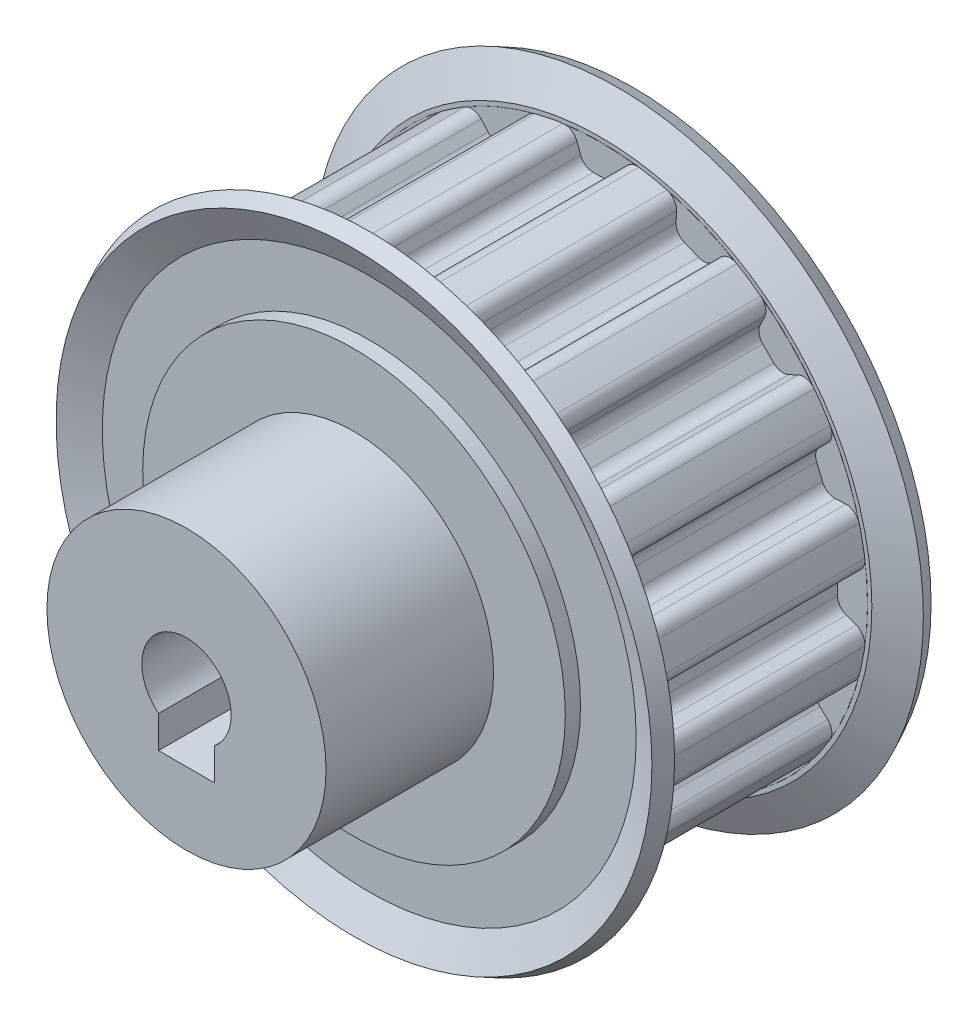
from build123d import *

# Parameters (mm, degrees)
TOOTH_EXTRUDE_START      = -9.6
TOOTH_EXTRUDE_DEPTH      = 19.2
PATTERN_CIRCULAR_1_COUNT = 16
SKETCH_8_R               = 12.5
EXTRUDE_1_DEPTH          = 15
SKETCH_3_R               = 4
CUT_EXTRUDE_2_DEPTH      = 56.639818872
SKETCH_9_W               = 5
SKETCH_9_H               = 2.877501001
CUT_EXTRUDE_4_DEPTH      = 56.639818872


with BuildPart() as part:
    # GearBelt-BaseSketch → 0.375in Pitch 'L', 0.500in Belt Width, 48.5104mm P.D. (revolve)
    with BuildSketch(Plane(origin=(0, 0, 0), x_dir=(0, 0, -1), z_dir=(1, 0, 0)), mode=Mode.PRIVATE) as f_0_375in_pitch_l_0_500in_belt_width_48_sk:
        Polygon((-12.5, 0), (12.5, 0), (12.5, 18.92121315), (11.136655508, 18.92121315), (11.136655508, 23.902323777), (12.5, 26.678029552), (11.136655665, 27.347663923), (9.617735498, 24.255213332), (9.617735498, 23.874213327), (-9.617735498, 23.874213327), (-9.617735498, 24.255213332), (-11.136655665, 27.347663923), (-12.5, 26.678029552), (-11.136655508, 23.902323777), (-11.136655508, 18.92121315), (-12.5, 18.92121315), align=None)
    revolve(f_0_375in_pitch_l_0_500in_belt_width_48_sk.sketch.rotate(Axis((0, 0, 14.2875), (0, 0, -1)), 90), axis=Axis((0, 0, 14.2875), (0, 0, -1)))

    # Tooth-Sketch → Tooth-Extrude (cut)
    with BuildSketch(Plane.XY.offset(TOOTH_EXTRUDE_START)):
        with BuildLine():
            Line((-0.690315485, 21.207213272), (0.690315485, 21.207213272))
            ThreePointArc((0.690315485, 21.207213272), (1.373229902, 21.422535361), (1.809136966, 21.990620509))
            Line((1.809136966, 21.990620509), (2.130908529, 22.874680616))
            ThreePointArc((2.130908529, 22.874680616), (2.628608351, 23.477498363), (3.394995979, 23.631590389))
            Line((3.394995979, 23.631590389), (3.394995979, 26.171590389))
            Line((3.394995979, 26.171590389), (-3.394995979, 26.171590389))
            Line((-3.394995979, 26.171590389), (-3.394995979, 23.631590389))
            ThreePointArc((-3.394995979, 23.631590389), (-2.628608351, 23.477498363), (-2.130908529, 22.874680616))
            Line((-2.130908529, 22.874680616), (-1.809136966, 21.990620509))
            ThreePointArc((-1.809136966, 21.990620509), (-1.373229902, 21.422535361), (-0.690315485, 21.207213272))
        make_face()
    tooth_extrude = extrude(amount=TOOTH_EXTRUDE_DEPTH, mode=Mode.SUBTRACT)

    # 阵列(圆周)1: Tooth-Extrude ×16 about axis
    pattern_circular_1_axis = Axis((0, 0, 0), (0, 0, 1))
    for i in range(1, PATTERN_CIRCULAR_1_COUNT):
        add(tooth_extrude.rotate(pattern_circular_1_axis, i * 360 / PATTERN_CIRCULAR_1_COUNT), mode=Mode.SUBTRACT)

    # 草图8 → 凸台-拉伸1 (add)
    with BuildSketch(Plane.XY.offset(12.5)):
        with Locations(Location((0, 0, 0), (0, 0, 180))):
            Circle(SKETCH_8_R)
    extrude(amount=EXTRUDE_1_DEPTH)

    # 草图3 → 切除-拉伸2 (cut, through all)
    with BuildSketch(Plane(origin=(0, 0, -12.5), x_dir=(-1, 0, 0), z_dir=(0, 0, -1))):
        Circle(SKETCH_3_R)
    extrude(amount=-CUT_EXTRUDE_2_DEPTH, mode=Mode.SUBTRACT)

    # 草图9 → 切除-拉伸4 (cut, through all)
    with BuildSketch(Plane.XY.offset(27.5)):
        with Locations((0, -4.5612495)):
            Rectangle(SKETCH_9_W, SKETCH_9_H)
    extrude(amount=-CUT_EXTRUDE_4_DEPTH, mode=Mode.SUBTRACT)


solid = part.part
